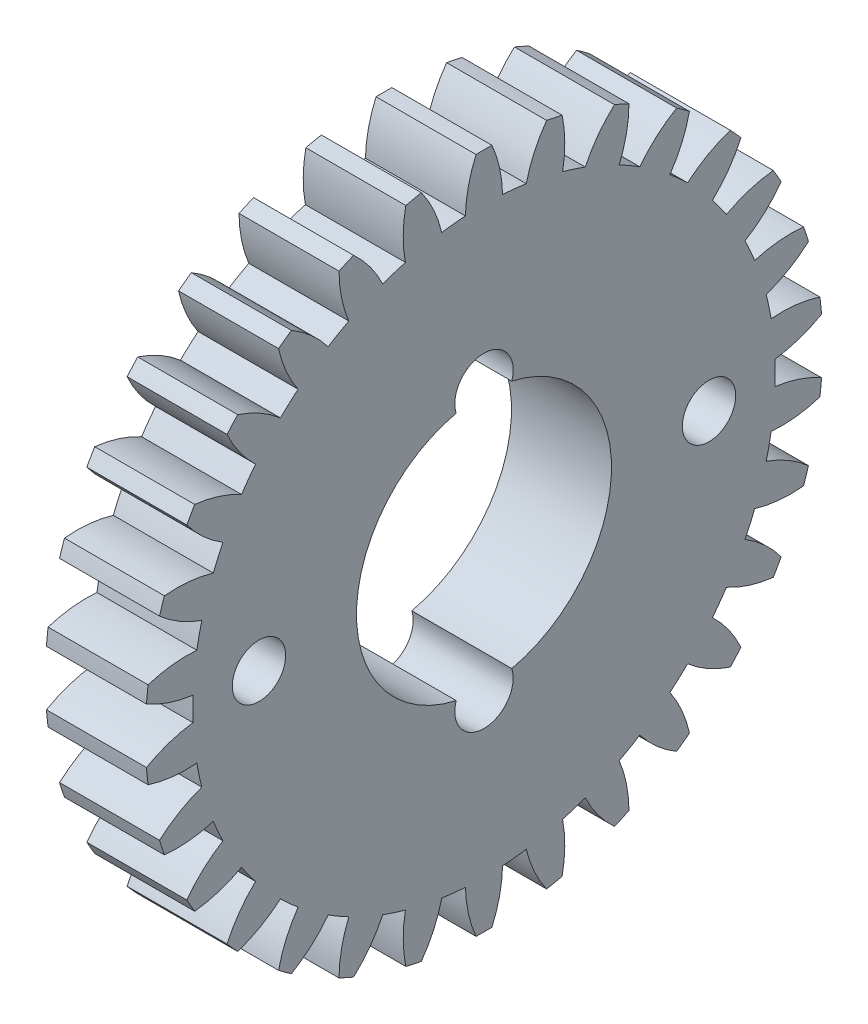
from build123d import *

# Parameters (mm, degrees)
ESBO_O1_R                  = 1.75
ESBO_O1_R_2                = 3
RESSALTO_EXTRUS_O1_DEPTH   = 6
CORTE_EXTRUS_O1_DEPTH      = 30.310152568
CORTE_EXTRUS_O1_DEPTH_BACK = 30.310152568
ESBO_O2_R                  = 1.6
ESBO_O2_R_2                = 7.65


with BuildPart() as part:
    # Esboço1 → Ressalto-extrusão1 (new body)
    with BuildSketch(Plane(origin=(0, 0, 0), x_dir=(0, -1, 0), z_dir=(-1, 0, 0))):
        with BuildLine():
            ThreePointArc((17.439635583, -1.114327495), (18.908103592, -0.935785134), (20.314403461, -0.476877358))
            ThreePointArc((20.314403461, -0.476877358), (20.32, 0), (20.314403461, 0.476877358))
            ThreePointArc((20.314403461, 0.476877358), (18.908103592, 0.935785134), (17.439635583, 1.114327495))
            ThreePointArc((17.439635583, 1.114327495), (17.379469026, 1.826655801), (17.290219417, 2.535927356))
            ThreePointArc((17.290219417, 2.535927356), (18.689476833, 3.015879804), (19.969633384, 3.757145528))
            ThreePointArc((19.969633384, 3.757145528), (19.875959247, 4.224765557), (19.771336628, 4.690058415))
            ThreePointArc((19.771336628, 4.690058415), (18.300355494, 4.846551772), (16.82685599, 4.715880887))
            ThreePointArc((16.82685599, 4.715880887), (16.619902834, 5.40013378), (16.385137694, 6.075350013))
            ThreePointArc((16.385137694, 6.075350013), (17.654030253, 6.835736324), (18.752094502, 7.826963126))
            ThreePointArc((18.752094502, 7.826963126), (18.563243699, 8.264888587), (18.364167511, 8.698261414))
            ThreePointArc((18.364167511, 8.698261414), (16.892794045, 8.545500841), (15.478662046, 8.111327655))
            ThreePointArc((15.478662046, 8.111327655), (15.133967136, 8.7376), (14.76394683, 9.349250721))
            ThreePointArc((14.76394683, 9.349250721), (15.847017839, 10.356838364), (16.714999109, 11.554704877))
            ThreePointArc((16.714999109, 11.554704877), (16.439225326, 11.943796327), (16.154396153, 12.32630865))
            ThreePointArc((16.154396153, 12.32630865), (14.746936436, 11.870970517), (13.453976295, 11.152270482))
            ThreePointArc((13.453976295, 11.152270482), (12.986604454, 11.693191172), (12.497500644, 12.21454431))
            ThreePointArc((12.497500644, 12.21454431), (13.347414702, 13.42529687), (13.947378047, 14.777450579))
            ThreePointArc((13.947378047, 14.777450579), (13.596733921, 15.100702854), (13.238600165, 15.41563705))
            ThreePointArc((13.238600165, 15.41563705), (11.956566942, 14.677621818), (10.841287221, 13.705805574))
            ThreePointArc((10.841287221, 13.705805574), (10.271664841, 14.13773378), (9.68485371, 14.546003701))
            ThreePointArc((9.68485371, 14.546003701), (10.264465495, 15.907005481), (10.570189637, 17.354350781))
            ThreePointArc((10.570189637, 17.354350781), (10.16, 17.597636205), (9.744213824, 17.831228139))
            ThreePointArc((9.744213824, 17.831228139), (8.643638098, 16.842790615), (7.754781873, 15.660331195))
            ThreePointArc((7.754781873, 15.660331195), (7.107804185, 15.964389581), (6.448932196, 16.24173293))
            ThreePointArc((6.448932196, 16.24173293), (6.732909891, 17.693501623), (6.731033219, 19.172782579))
            ThreePointArc((6.731033219, 19.172782579), (6.279225326, 19.325468411), (5.823958582, 19.467508994))
            ThreePointArc((5.823958582, 19.467508994), (4.952940792, 18.271848642), (4.329355346, 16.930425196))
            ThreePointArc((4.329355346, 16.930425196), (3.633298379, 17.093324952), (2.931161399, 17.227620494))
            ThreePointArc((2.931161399, 17.227620494), (2.907093817, 18.70670684), (2.59769835, 20.153271776))
            ThreePointArc((2.59769835, 20.153271776), (2.124018374, 20.208684914), (1.649168402, 20.252966291))
            ThreePointArc((1.649168402, 20.252966291), (1.045776207, 18.902339204), (0.714715216, 17.460578375))
            ThreePointArc((0.714715216, 17.460578375), (0, 17.4752), (-0.714715216, 17.460578375))
            ThreePointArc((-0.714715216, 17.460578375), (-1.045776207, 18.902339204), (-1.649168402, 20.252966291))
            ThreePointArc((-1.649168402, 20.252966291), (-2.124018374, 20.208684914), (-2.59769835, 20.153271776))
            ThreePointArc((-2.59769835, 20.153271776), (-2.907093817, 18.70670684), (-2.931161399, 17.227620494))
            ThreePointArc((-2.931161399, 17.227620494), (-3.633298379, 17.093324952), (-4.329355346, 16.930425196))
            ThreePointArc((-4.329355346, 16.930425196), (-4.952940792, 18.271848642), (-5.823958582, 19.467508994))
            ThreePointArc((-5.823958582, 19.467508994), (-6.279225326, 19.325468411), (-6.731033219, 19.172782579))
            ThreePointArc((-6.731033219, 19.172782579), (-6.732909891, 17.693501623), (-6.448932196, 16.24173293))
            ThreePointArc((-6.448932196, 16.24173293), (-7.107804185, 15.964389581), (-7.754781873, 15.660331195))
            ThreePointArc((-7.754781873, 15.660331195), (-8.643638098, 16.842790615), (-9.744213824, 17.831228139))
            ThreePointArc((-9.744213824, 17.831228139), (-10.16, 17.597636205), (-10.570189637, 17.354350781))
            ThreePointArc((-10.570189637, 17.354350781), (-10.264465495, 15.907005481), (-9.68485371, 14.546003701))
            ThreePointArc((-9.68485371, 14.546003701), (-10.271664841, 14.13773378), (-10.841287221, 13.705805574))
            ThreePointArc((-10.841287221, 13.705805574), (-11.956566942, 14.677621818), (-13.238600165, 15.41563705))
            ThreePointArc((-13.238600165, 15.41563705), (-13.596733921, 15.100702854), (-13.947378047, 14.777450579))
            ThreePointArc((-13.947378047, 14.777450579), (-13.347414702, 13.42529687), (-12.497500644, 12.21454431))
            ThreePointArc((-12.497500644, 12.21454431), (-12.986604454, 11.693191172), (-13.453976295, 11.152270482))
            ThreePointArc((-13.453976295, 11.152270482), (-14.746936436, 11.870970517), (-16.154396153, 12.32630865))
            ThreePointArc((-16.154396153, 12.32630865), (-16.439225326, 11.943796327), (-16.714999109, 11.554704877))
            ThreePointArc((-16.714999109, 11.554704877), (-15.847017839, 10.356838364), (-14.76394683, 9.349250721))
            ThreePointArc((-14.76394683, 9.349250721), (-15.133967136, 8.7376), (-15.478662046, 8.111327655))
            ThreePointArc((-15.478662046, 8.111327655), (-16.892794045, 8.545500841), (-18.364167511, 8.698261414))
            ThreePointArc((-18.364167511, 8.698261414), (-18.563243699, 8.264888587), (-18.752094502, 7.826963126))
            ThreePointArc((-18.752094502, 7.826963126), (-17.654030253, 6.835736324), (-16.385137694, 6.075350013))
            ThreePointArc((-16.385137694, 6.075350013), (-16.619902834, 5.40013378), (-16.82685599, 4.715880887))
            ThreePointArc((-16.82685599, 4.715880887), (-18.300355494, 4.846551772), (-19.771336628, 4.690058415))
            ThreePointArc((-19.771336628, 4.690058415), (-19.875959247, 4.224765557), (-19.969633384, 3.757145528))
            ThreePointArc((-19.969633384, 3.757145528), (-18.689476833, 3.015879804), (-17.290219417, 2.535927356))
            ThreePointArc((-17.290219417, 2.535927356), (-17.379469026, 1.826655801), (-17.439635583, 1.114327495))
            ThreePointArc((-17.439635583, 1.114327495), (-18.908103592, 0.935785134), (-20.314403461, 0.476877358))
            ThreePointArc((-20.314403461, 0.476877358), (-20.32, 0), (-20.314403461, -0.476877358))
            ThreePointArc((-20.314403461, -0.476877358), (-18.908103592, -0.935785134), (-17.439635583, -1.114327495))
            ThreePointArc((-17.439635583, -1.114327495), (-17.379469026, -1.826655801), (-17.290219417, -2.535927356))
            ThreePointArc((-17.290219417, -2.535927356), (-18.689476833, -3.015879804), (-19.969633384, -3.757145528))
            ThreePointArc((-19.969633384, -3.757145528), (-19.875959247, -4.224765557), (-19.771336628, -4.690058415))
            ThreePointArc((-19.771336628, -4.690058415), (-18.300355494, -4.846551772), (-16.82685599, -4.715880887))
            ThreePointArc((-16.82685599, -4.715880887), (-16.619902834, -5.40013378), (-16.385137694, -6.075350013))
            ThreePointArc((-16.385137694, -6.075350013), (-17.654030253, -6.835736324), (-18.752094502, -7.826963126))
            ThreePointArc((-18.752094502, -7.826963126), (-18.563243699, -8.264888587), (-18.364167511, -8.698261414))
            ThreePointArc((-18.364167511, -8.698261414), (-16.892794045, -8.545500841), (-15.478662046, -8.111327655))
            ThreePointArc((-15.478662046, -8.111327655), (-15.133967136, -8.7376), (-14.76394683, -9.349250721))
            ThreePointArc((-14.76394683, -9.349250721), (-15.847017839, -10.356838364), (-16.714999109, -11.554704877))
            ThreePointArc((-16.714999109, -11.554704877), (-16.439225326, -11.943796327), (-16.154396153, -12.32630865))
            ThreePointArc((-16.154396153, -12.32630865), (-14.746936436, -11.870970517), (-13.453976295, -11.152270482))
            ThreePointArc((-13.453976295, -11.152270482), (-12.986604454, -11.693191172), (-12.497500644, -12.21454431))
            ThreePointArc((-12.497500644, -12.21454431), (-13.347414702, -13.42529687), (-13.947378047, -14.777450579))
            ThreePointArc((-13.947378047, -14.777450579), (-13.596733921, -15.100702854), (-13.238600165, -15.41563705))
            ThreePointArc((-13.238600165, -15.41563705), (-11.956566942, -14.677621818), (-10.841287221, -13.705805574))
            ThreePointArc((-10.841287221, -13.705805574), (-10.271664841, -14.13773378), (-9.68485371, -14.546003701))
            ThreePointArc((-9.68485371, -14.546003701), (-10.264465495, -15.907005481), (-10.570189637, -17.354350781))
            ThreePointArc((-10.570189637, -17.354350781), (-10.16, -17.597636205), (-9.744213824, -17.831228139))
            ThreePointArc((-9.744213824, -17.831228139), (-8.643638098, -16.842790615), (-7.754781873, -15.660331195))
            ThreePointArc((-7.754781873, -15.660331195), (-7.107804185, -15.964389581), (-6.448932196, -16.24173293))
            ThreePointArc((-6.448932196, -16.24173293), (-6.732909891, -17.693501623), (-6.731033219, -19.172782579))
            ThreePointArc((-6.731033219, -19.172782579), (-6.279225326, -19.325468411), (-5.823958582, -19.467508994))
            ThreePointArc((-5.823958582, -19.467508994), (-4.952940792, -18.271848642), (-4.329355346, -16.930425196))
            ThreePointArc((-4.329355346, -16.930425196), (-3.633298379, -17.093324952), (-2.931161399, -17.227620494))
            ThreePointArc((-2.931161399, -17.227620494), (-2.907093817, -18.70670684), (-2.59769835, -20.153271776))
            ThreePointArc((-2.59769835, -20.153271776), (-2.124018374, -20.208684914), (-1.649168402, -20.252966291))
            ThreePointArc((-1.649168402, -20.252966291), (-1.045776207, -18.902339204), (-0.714715216, -17.460578375))
            ThreePointArc((-0.714715216, -17.460578375), (0, -17.4752), (0.714715216, -17.460578375))
            ThreePointArc((0.714715216, -17.460578375), (1.045776207, -18.902339204), (1.649168402, -20.252966291))
            ThreePointArc((1.649168402, -20.252966291), (2.124018374, -20.208684914), (2.59769835, -20.153271776))
            ThreePointArc((2.59769835, -20.153271776), (2.907093817, -18.70670684), (2.931161399, -17.227620494))
            ThreePointArc((2.931161399, -17.227620494), (3.633298379, -17.093324952), (4.329355346, -16.930425196))
            ThreePointArc((4.329355346, -16.930425196), (4.952940792, -18.271848642), (5.823958582, -19.467508994))
            ThreePointArc((5.823958582, -19.467508994), (6.279225326, -19.325468411), (6.731033219, -19.172782579))
            ThreePointArc((6.731033219, -19.172782579), (6.732909891, -17.693501623), (6.448932196, -16.24173293))
            ThreePointArc((6.448932196, -16.24173293), (7.107804185, -15.964389581), (7.754781873, -15.660331195))
            ThreePointArc((7.754781873, -15.660331195), (8.643638098, -16.842790615), (9.744213824, -17.831228139))
            ThreePointArc((9.744213824, -17.831228139), (10.16, -17.597636205), (10.570189637, -17.354350781))
            ThreePointArc((10.570189637, -17.354350781), (10.264465495, -15.907005481), (9.68485371, -14.546003701))
            ThreePointArc((9.68485371, -14.546003701), (10.271664841, -14.13773378), (10.841287221, -13.705805574))
            ThreePointArc((10.841287221, -13.705805574), (11.956566942, -14.677621818), (13.238600165, -15.41563705))
            ThreePointArc((13.238600165, -15.41563705), (13.596733921, -15.100702854), (13.947378047, -14.777450579))
            ThreePointArc((13.947378047, -14.777450579), (13.347414702, -13.42529687), (12.497500644, -12.21454431))
            ThreePointArc((12.497500644, -12.21454431), (12.986604454, -11.693191172), (13.453976295, -11.152270482))
            ThreePointArc((13.453976295, -11.152270482), (14.746936436, -11.870970517), (16.154396153, -12.32630865))
            ThreePointArc((16.154396153, -12.32630865), (16.439225326, -11.943796327), (16.714999109, -11.554704877))
            ThreePointArc((16.714999109, -11.554704877), (15.847017839, -10.356838364), (14.76394683, -9.349250721))
            ThreePointArc((14.76394683, -9.349250721), (15.133967136, -8.7376), (15.478662046, -8.111327655))
            ThreePointArc((15.478662046, -8.111327655), (16.892794045, -8.545500841), (18.364167511, -8.698261414))
            ThreePointArc((18.364167511, -8.698261414), (18.563243699, -8.264888587), (18.752094502, -7.826963126))
            ThreePointArc((18.752094502, -7.826963126), (17.654030253, -6.835736324), (16.385137694, -6.075350013))
            ThreePointArc((16.385137694, -6.075350013), (16.619902834, -5.40013378), (16.82685599, -4.715880887))
            ThreePointArc((16.82685599, -4.715880887), (18.300355494, -4.846551772), (19.771336628, -4.690058415))
            ThreePointArc((19.771336628, -4.690058415), (19.875959247, -4.224765557), (19.969633384, -3.757145528))
            ThreePointArc((19.969633384, -3.757145528), (18.689476833, -3.015879804), (17.290219417, -2.535927356))
            ThreePointArc((17.290219417, -2.535927356), (17.379469026, -1.826655801), (17.439635583, -1.114327495))
        make_face()
        with Locations(Location((8, 0, 0), (0, 0, 270))):
            Circle(ESBO_O1_R, mode=Mode.SUBTRACT)
        with Locations(Location((0, 0, 0), (0, 0, 270))):
            Circle(ESBO_O1_R_2, mode=Mode.SUBTRACT)
        with Locations(Location((-8, 0, 0), (0, 0, 270))):
            Circle(ESBO_O1_R, mode=Mode.SUBTRACT)
    extrude(amount=-RESSALTO_EXTRUS_O1_DEPTH)

    # Esboço2 → Corte-extrusão1 (cut, two sides: drawn at the far end of the back side and taken through both)
    with BuildSketch(Plane(origin=(6, 0, 0), x_dir=(0, 0, -1), z_dir=(1, 0, 0)).offset(-CORTE_EXTRUS_O1_DEPTH_BACK)):
        with Locations((-13.5, 0)):
            Circle(ESBO_O2_R)
        with Locations((13.5, 0)):
            Circle(ESBO_O2_R)
        Circle(ESBO_O2_R_2)
    extrude(amount=CORTE_EXTRUS_O1_DEPTH + CORTE_EXTRUS_O1_DEPTH_BACK, mode=Mode.SUBTRACT)


solid = part.part
